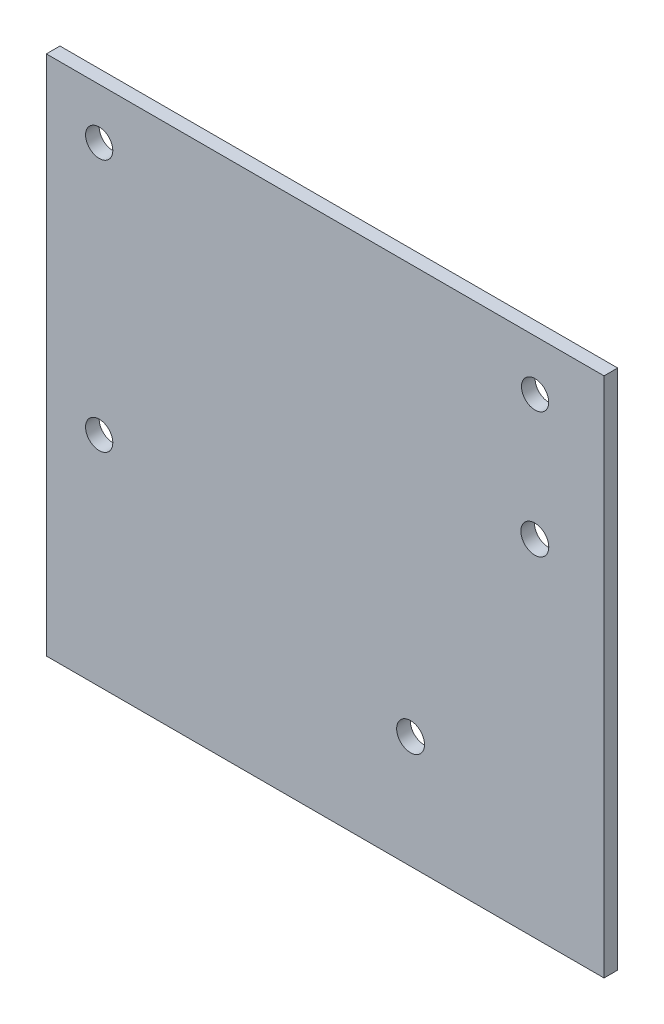
from build123d import *

# Parameters (mm, degrees)
SKETCH1_W           = 129.980051375
SKETCH1_H           = 121.538769524
SKETCH1_R           = 3.175
SKETCH1_R_2         = 3.2512
BOSS_EXTRUDE1_DEPTH = 3.175


with BuildPart() as part:
    # Sketch1 → Boss-Extrude1 (new body)
    with BuildSketch(Plane.XY):
        with Locations((27.274015196, 245.826527619)):
            Rectangle(SKETCH1_W, SKETCH1_H)
        with Locations((-25.4, 235.857142857)):
            Circle(SKETCH1_R, mode=Mode.SUBTRACT)
        with Locations((-25.4, 294.821428571)):
            Circle(SKETCH1_R, mode=Mode.SUBTRACT)
        with Locations((76.2, 294.821428571)):
            Circle(SKETCH1_R, mode=Mode.SUBTRACT)
        with Locations((76.132649113, 265.583474471)):
            Circle(SKETCH1_R_2, mode=Mode.SUBTRACT)
        with Locations((47.176649113, 211.227474471)):
            Circle(SKETCH1_R_2, mode=Mode.SUBTRACT)
    extrude(amount=BOSS_EXTRUDE1_DEPTH)


solid = part.part
